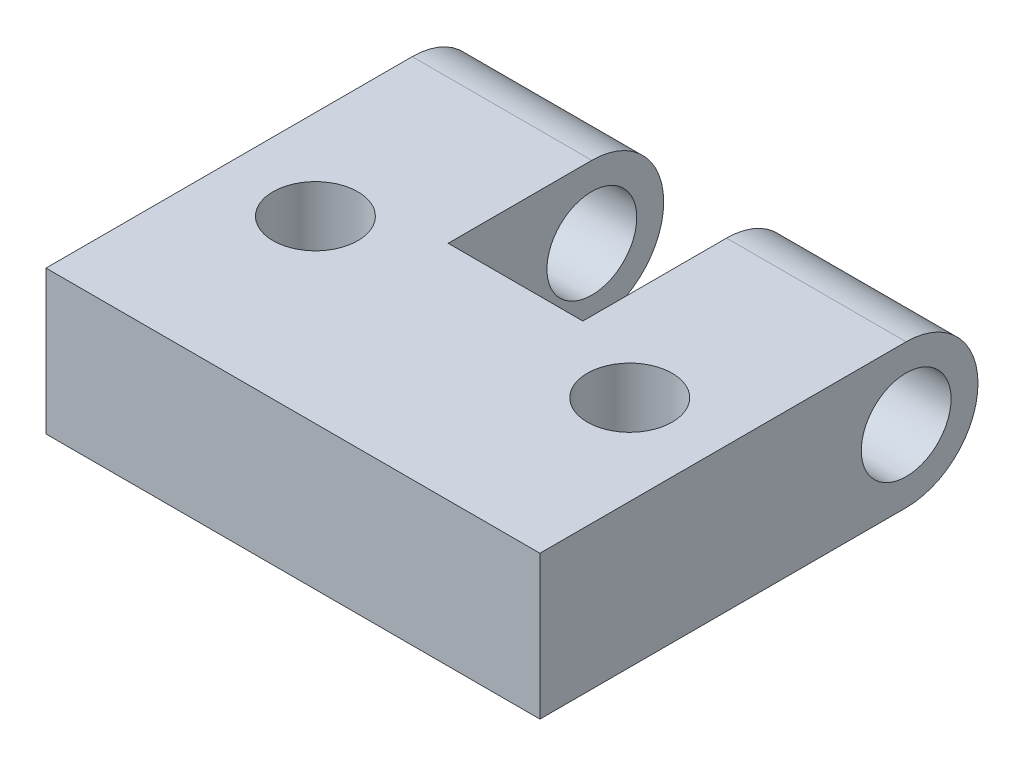
from build123d import *

# Parameters (mm, degrees)
SKETCH2_W           = 6.35
SKETCH2_H           = 5.08
SKETCH2_R           = 1.5875
BOSS_EXTRUDE1_DEPTH = 6.35
SKETCH3_R           = 1.5
CUT_EXTRUDE1_DEPTH  = 13.2322679
BOSS_EXTRUDE2_DEPTH = 4.7625


with BuildPart() as part:
    # Sketch2 → Boss-Extrude1 (new body)
    # profile 1 of 2: a face of its own
    with BuildSketch(Plane(origin=(0, 0, 0), x_dir=(0, 0, -1), z_dir=(1, 0, 0))):
        with Locations((-3.175, 2.54)):
            Rectangle(SKETCH2_W, SKETCH2_H)
    # profile 2 of 2: a face of its own
    with BuildSketch(Plane(origin=(0, 0, 0), x_dir=(0, 0, -1), z_dir=(1, 0, 0))):
        with BuildLine():
            Line((6.597804878, 5.08), (0, 5.08))
            Line((0, 5.08), (0, 0))
            Line((0, 0), (6.597804878, 0))
            ThreePointArc((6.597804878, 0), (9.137804878, 2.54), (6.597804878, 5.08))
        make_face()
        with Locations((6.597804878, 2.54)):
            Circle(SKETCH2_R, mode=Mode.SUBTRACT)
    boss_extrude1 = extrude(amount=BOSS_EXTRUDE1_DEPTH)

    # Sketch3 → Cut-Extrude1 (cut, through all)
    with BuildSketch(Plane(origin=(0, 5.08, 0), x_dir=(1, 0, 0), z_dir=(0, 1, 0))):
        with Locations(Location((3.175, 0, 0), (0, 0, 270))):
            Circle(SKETCH3_R)
    cut_extrude1 = extrude(amount=-CUT_EXTRUDE1_DEPTH, mode=Mode.SUBTRACT)

    # Sketch4 → Boss-Extrude2 (add)
    with BuildSketch(Plane(origin=(6.35, 0, 0), x_dir=(0, 0, -1), z_dir=(1, 0, 0))):
        Polygon((-6.35, 0), (1.517804878, 0), (1.517804878, 2.54), (1.517804878, 5.08), (-6.35, 5.08), align=None)
    extrude(amount=BOSS_EXTRUDE2_DEPTH)

    # Mirror1: Boss-Extrude1, Cut-Extrude1 across plane
    add(boss_extrude1.mirror(Plane(origin=(8.73125, 0, 0), x_dir=(0, 0, 1), z_dir=(1, 0, 0))))
    add(cut_extrude1.mirror(Plane(origin=(8.73125, 0, 0), x_dir=(0, 0, 1), z_dir=(1, 0, 0))), mode=Mode.SUBTRACT)


solid = part.part
